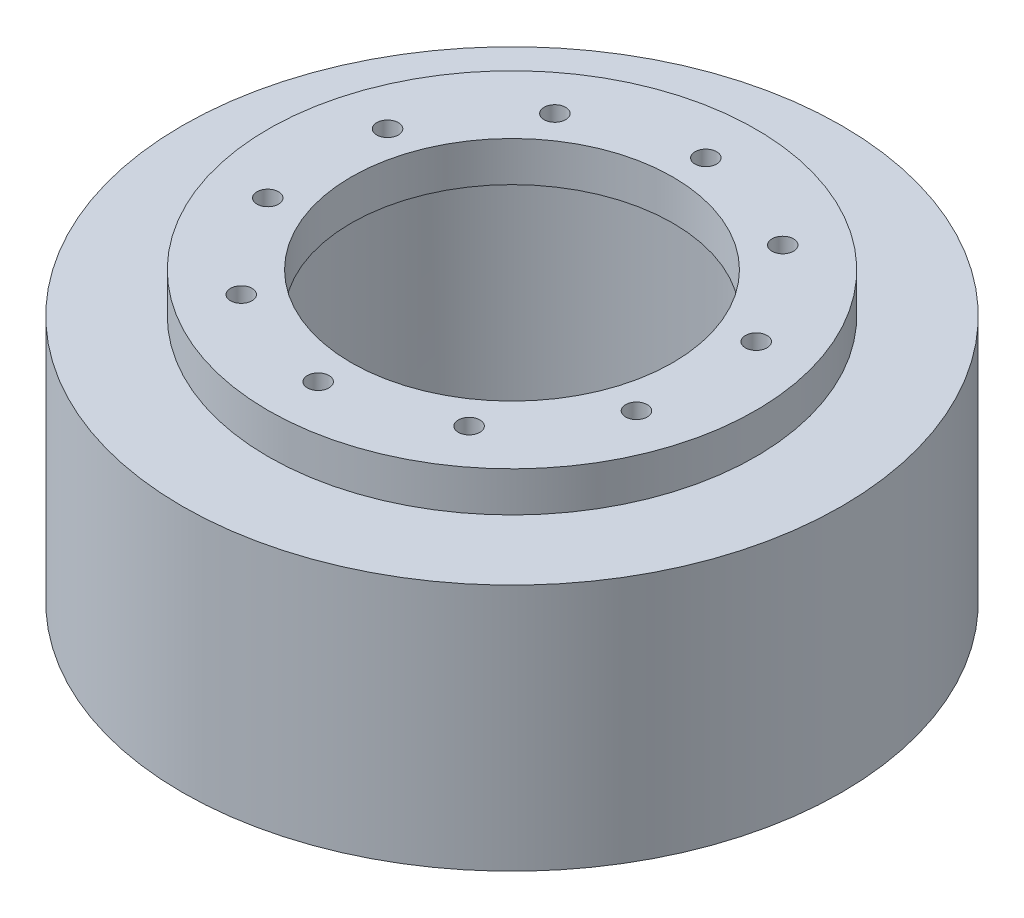
from build123d import *

# Parameters (mm, degrees)
SKETCH1_R                                  = 82.5
SKETCH1_R_2                                = 55
BOSS_EXTRUDE1_DEPTH                        = 62
SKETCH6_R                                  = 61
BOSS_EXTRUDE4_DEPTH                        = 10
SKETCH8_R                                  = 40.25
CUT_EXTRUDE4_DEPTH                         = 10
SKETCH9_R                                  = 2.7
CUT_EXTRUDE5_DEPTH                         = 30
CIRPATTERN6_COUNT                          = 10
SKETCH10_R                                 = 4.66
CUT_EXTRUDE6_DEPTH                         = 7.62
CIRPATTERN7_COUNT                          = 6
SKETCH12_W                                 = 20
SKETCH12_H                                 = 41
CUT_EXTRUDE7_DEPTH                         = 11.3
SKETCH13_R                                 = 4.66
CUT_EXTRUDE8_DEPTH                         = 7.62
MIRROR2_AT_THE_SECOND_PLANE_COPY_1_SKETC_R = 4.66
MIRROR2_AT_THE_SECOND_PLANE_COPY_1_DEPTH   = 7.62


with BuildPart() as part:
    # Sketch1 → Boss-Extrude1 (new body)
    with BuildSketch(Plane(origin=(0, 0, 0), x_dir=(1, 0, 0), z_dir=(0, 1, 0))):
        with Locations(Location((0, 0, 0), (0, 0, 270))):
            Circle(SKETCH1_R)
        with Locations(Location((0, 0, 0), (0, 0, 270))):
            Circle(SKETCH1_R_2, mode=Mode.SUBTRACT)
    extrude(amount=BOSS_EXTRUDE1_DEPTH)

    # Sketch6 → Boss-Extrude4 (add)
    with BuildSketch(Plane(origin=(0, 62, 0), x_dir=(1, 0, 0), z_dir=(0, 1, 0))):
        with Locations(Location((0, 0, 0), (0, 0, 270))):
            Circle(SKETCH6_R)
    extrude(amount=BOSS_EXTRUDE4_DEPTH)

    # Sketch8 → Cut-Extrude4 (cut)
    with BuildSketch(Plane(origin=(0, 72, 0), x_dir=(1, 0, 0), z_dir=(0, 1, 0))):
        with Locations(Location((0, 0, 0), (0, 0, 270))):
            Circle(SKETCH8_R)
    extrude(amount=-CUT_EXTRUDE4_DEPTH, mode=Mode.SUBTRACT)

    # Sketch9 → Cut-Extrude5 (cut)
    with BuildSketch(Plane(origin=(0, 72, 0), x_dir=(1, 0, 0), z_dir=(0, 1, 0))):
        with Locations(Location((0, 48.5, 0), (0, 0, 270))):
            Circle(SKETCH9_R)
    cut_extrude5 = extrude(amount=-CUT_EXTRUDE5_DEPTH, mode=Mode.SUBTRACT)

    # CirPattern6: Cut-Extrude5 ×10 about axis
    cirpattern6_axis = Axis((0, 0, 0), (0, 1, 0))
    for i in range(1, CIRPATTERN6_COUNT):
        add(cut_extrude5.rotate(cirpattern6_axis, i * 360 / CIRPATTERN6_COUNT), mode=Mode.SUBTRACT)

    # Sketch10 → Cut-Extrude6 (cut)
    with BuildSketch(Plane.XZ):
        with Locations(Location((0, 69.5, 0), (0, 0, 270))):
            Circle(SKETCH10_R)
    cut_extrude6 = extrude(amount=-CUT_EXTRUDE6_DEPTH, mode=Mode.SUBTRACT)

    # CirPattern7: Cut-Extrude6 ×6 about axis
    cirpattern7_axis = Axis((0, 0, 0), (0, 1, 0))
    for i in range(1, CIRPATTERN7_COUNT):
        add(cut_extrude6.rotate(cirpattern7_axis, i * 360 / CIRPATTERN7_COUNT), mode=Mode.SUBTRACT)

    # Sketch12 → Cut-Extrude7 (cut)
    with BuildSketch(Plane.XZ):
        with Locations((61.036751464, 0)):
            Rectangle(SKETCH12_W, SKETCH12_H)
    cut_extrude7 = extrude(amount=-CUT_EXTRUDE7_DEPTH, mode=Mode.SUBTRACT)

    # Mirror1: Cut-Extrude7 across plane
    add(cut_extrude7.mirror(Plane(origin=(0, 0, 0), x_dir=(0, 0, 1), z_dir=(1, 0, 0))), mode=Mode.SUBTRACT)

    # Sketch13 → Cut-Extrude8 (cut)
    with BuildSketch(Plane.XZ.offset(-11.3)):
        with Locations(Location((63, 10.5, 0), (0, 0, 270))):
            Circle(SKETCH13_R)
    cut_extrude8 = extrude(amount=-CUT_EXTRUDE8_DEPTH, mode=Mode.SUBTRACT)

    # Mirror2: Cut-Extrude8 across plane
    add(cut_extrude8.mirror(Plane(origin=(0, 0, 0), x_dir=(0, 0, 1), z_dir=(1, 0, 0))), mode=Mode.SUBTRACT)

    # Mirror2 at the second plane: Cut-Extrude8 across plane
    add(cut_extrude8.mirror(Plane.XY), mode=Mode.SUBTRACT)

    # Mirror2 at the second plane copy 1 sketc → Mirror2 at the second plane copy 1 (cut)
    with BuildSketch(Plane(origin=(0, 11.3, 0), x_dir=(-1, 0, 0), z_dir=(0, -1, 0))):
        with Locations(Location((63, 10.5, 0), (0, 0, 270))):
            Circle(MIRROR2_AT_THE_SECOND_PLANE_COPY_1_SKETC_R)
    extrude(amount=-MIRROR2_AT_THE_SECOND_PLANE_COPY_1_DEPTH, mode=Mode.SUBTRACT)


solid = part.part
